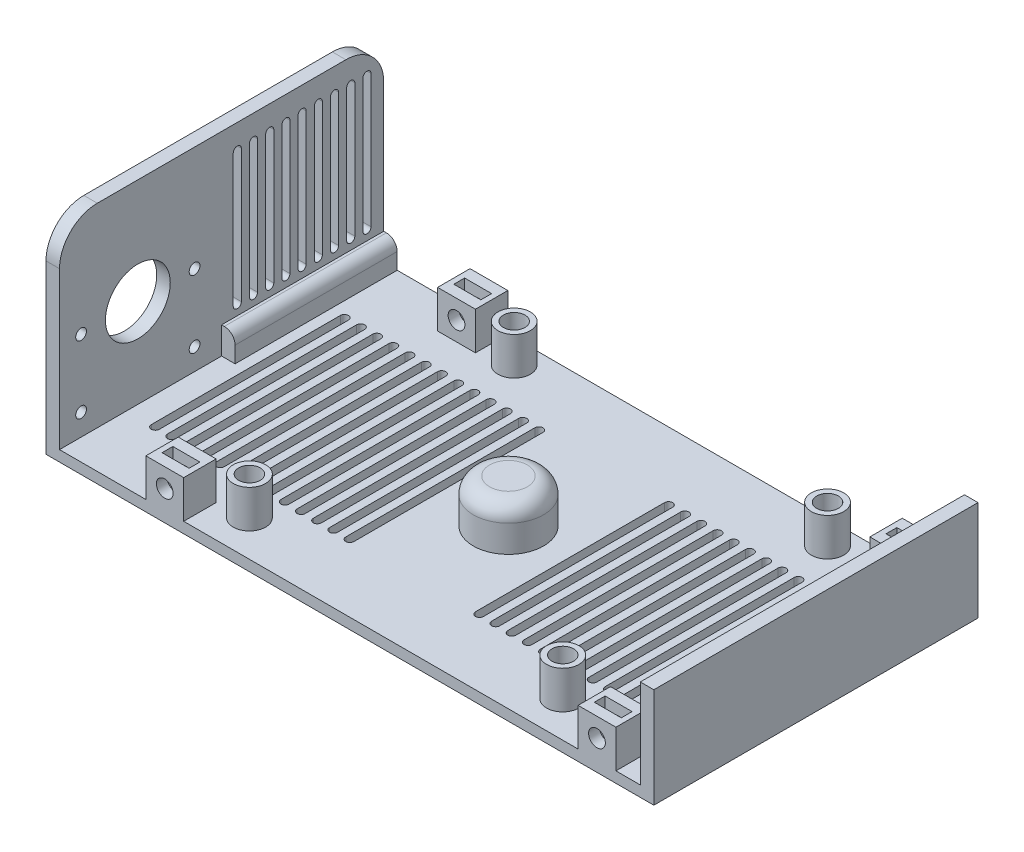
from build123d import *

# Parameters (mm, degrees)
SKETCH1_W            = 110
SKETCH1_H            = 60
BOSS_EXTRUDE1_DEPTH  = 2
SKETCH2_R            = 3
BOSS_EXTRUDE2_DEPTH  = 7
BOSS_EXTRUDE3_DEPTH  = 2.5
CUT_EXTRUDE1_REACH   = 135.042
SKETCH5_R            = 6
SKETCH6_R            = 2.5
CUT_EXTRUDE2_DEPTH   = 1
SKETCH7_R            = 1
CUT_EXTRUDE7_DEPTH   = 2.5
SKETCH8_W            = 7
SKETCH8_H            = 7
BOSS_EXTRUDE5_DEPTH  = 6
CUT_EXTRUDE9_DEPTH   = 2
SKETCH11_R           = 1.55
CUT_EXTRUDE11_DEPTH  = 131.935098427
LPATTERN1_COUNT      = 2
LPATTERN1_PITCH      = 80
LPATTERN1_COUNT_DIR2 = 2
LPATTERN1_PITCH_DIR2 = 54
SKETCH12_W           = 60
SKETCH12_H           = 16.51283607
BOSS_EXTRUDE6_DEPTH  = 2.5
SKETCH14_R           = 2
CUT_EXTRUDE12_DEPTH  = 6.5
CUT_EXTRUDE15_DEPTH  = 2.5
LPATTERN5_COUNT      = 9
LPATTERN5_PITCH      = 3
SKETCH17_R           = 6.5
BOSS_EXTRUDE7_DEPTH  = 8
SKETCH18_R           = 4.5
CUT_EXTRUDE16_DEPTH  = 8
FILLET2_R            = 3
CUT_EXTRUDE18_DEPTH  = 2
LPATTERN7_COUNT      = 34
LPATTERN7_PITCH      = 3
BOSS_EXTRUDE9_DEPTH  = 30


with BuildPart() as part:
    # Sketch1 → Boss-Extrude1 (new body)
    with BuildSketch(Plane(origin=(0, 0, 0), x_dir=(1, 0, 0), z_dir=(0, 1, 0))):
        with Locations((55, -30)):
            Rectangle(SKETCH1_W, SKETCH1_H)
    extrude(amount=BOSS_EXTRUDE1_DEPTH)

    # Sketch2 → Boss-Extrude2 (add)
    with BuildSketch(Plane(origin=(0, 2, 0), x_dir=(1, 0, 0), z_dir=(0, 1, 0))):
        with Locations(Location((28.5, -4.35, 0), (0, 0, 270))):
            Circle(SKETCH2_R)
        with Locations(Location((86.5, -4.35, 0), (0, 0, 270))):
            Circle(SKETCH2_R)
        with Locations(Location((28.5, -53.35, 0), (0, 0, 270))):
            Circle(SKETCH2_R)
        with Locations(Location((86.5, -53.35, 0), (0, 0, 270))):
            Circle(SKETCH2_R)
    extrude(amount=BOSS_EXTRUDE2_DEPTH)

    # Sketch3 → Boss-Extrude3 (add)
    with BuildSketch(Plane.ZY):
        with BuildLine():
            Line((0, 0), (60, 0))
            Line((60, 0), (60, 31))
            ThreePointArc((60, 31), (57.949747468, 35.949747468), (53, 38))
            Line((53, 38), (7, 38))
            ThreePointArc((7, 38), (2.050252532, 35.949747468), (0, 31))
            Line((0, 31), (0, 0))
        make_face()
    extrude(amount=BOSS_EXTRUDE3_DEPTH)

    # Sketch5 → Cut-Extrude1 (cut, up to next)
    with BuildSketch(Plane.ZY.offset(2.5), mode=Mode.PRIVATE) as cut_extrude1_sk1:
        with Locations((45.5, 18.5)):
            Circle(SKETCH5_R)
    cut_extrude1_tool1 = extrude(cut_extrude1_sk1.sketch, amount=-CUT_EXTRUDE1_REACH, mode=Mode.PRIVATE) & part.part
    add(cut_extrude1_tool1.solids().sort_by_distance((-2.5, 18.5, 45.5))[0], mode=Mode.SUBTRACT)

    # Sketch6 → Cut-Extrude2 (cut)
    with BuildSketch(Plane.ZY.offset(2.5)):
        with Locations((56, 18.5)):
            Circle(SKETCH6_R)
        with Locations((35, 18.5)):
            Circle(SKETCH6_R)
        with Locations((35, 6)):
            Circle(SKETCH6_R)
        with Locations((56, 6)):
            Circle(SKETCH6_R)
    extrude(amount=-CUT_EXTRUDE2_DEPTH, mode=Mode.SUBTRACT)

    # Sketch7 → Cut-Extrude7 (cut)
    with BuildSketch(Plane.ZY.offset(2.5)):
        with Locations((35, 18.5)):
            Circle(SKETCH7_R)
        with Locations((35, 6)):
            Circle(SKETCH7_R)
        with Locations((56, 6)):
            Circle(SKETCH7_R)
        with Locations((56, 18.5)):
            Circle(SKETCH7_R)
    extrude(amount=-CUT_EXTRUDE7_DEPTH, mode=Mode.SUBTRACT)

    # Sketch8 → Boss-Extrude5 (add)
    with BuildSketch(Plane.XY.offset(60)):
        with Locations((99.480486657, 5.5)):
            Rectangle(SKETCH8_W, SKETCH8_H)
    boss_extrude5 = extrude(amount=-BOSS_EXTRUDE5_DEPTH)

    # Sketch9 → Cut-Extrude9 (cut)
    with BuildSketch(Plane.XY.offset(58)):
        Polygon((99.480486657, 2.613248654), (101.980486657, 4.056624327), (101.980486657, 9), (96.980486657, 9), (96.980486657, 4.056624327), align=None)
    cut_extrude9 = extrude(amount=-CUT_EXTRUDE9_DEPTH, mode=Mode.SUBTRACT)

    # Sketch11 → Cut-Extrude11 (cut, through all)
    with BuildSketch(Plane.XY.offset(60)):
        with Locations((99.480486657, 5.5)):
            Circle(SKETCH11_R)
    cut_extrude11 = extrude(amount=-CUT_EXTRUDE11_DEPTH, mode=Mode.SUBTRACT)

    # LPattern1: Boss-Extrude5, Cut-Extrude9, Cut-Extrude11 2 × 2
    with Locations(*[(-i * LPATTERN1_PITCH, 0, -j * LPATTERN1_PITCH_DIR2) for i in range(LPATTERN1_COUNT) for j in range(LPATTERN1_COUNT_DIR2) if (i, j) != (0, 0)]):
        add(boss_extrude5)
        add(cut_extrude9, mode=Mode.SUBTRACT)
        add(cut_extrude11, mode=Mode.SUBTRACT)

    # Sketch12 → Boss-Extrude6 (add)
    with BuildSketch(Plane(origin=(110, 0, 0), x_dir=(0, 0, -1), z_dir=(1, 0, 0))):
        with Locations((-30, 10.256418035)):
            Rectangle(SKETCH12_W, SKETCH12_H)
    extrude(amount=-BOSS_EXTRUDE6_DEPTH)

    # Sketch14 → Cut-Extrude12 (cut)
    with BuildSketch(Plane(origin=(0, 9, 0), x_dir=(1, 0, 0), z_dir=(0, 1, 0))):
        with Locations(Location((28.5, -53.35, 0), (0, 0, 270))):
            Circle(SKETCH14_R)
        with Locations(Location((86.5, -53.35, 0), (0, 0, 270))):
            Circle(SKETCH14_R)
        with Locations(Location((28.5, -4.35, 0), (0, 0, 270))):
            Circle(SKETCH14_R)
        with Locations(Location((86.5, -4.35, 0), (0, 0, 270))):
            Circle(SKETCH14_R)
    extrude(amount=-CUT_EXTRUDE12_DEPTH, mode=Mode.SUBTRACT)

    # Sketch15 → Cut-Extrude15 (cut)
    with BuildSketch(Plane.ZY.offset(2.5)):
        with BuildLine():
            Line((3.842859367, 33.468156302), (3.842859367, 8.893132063))
            ThreePointArc((3.842859367, 8.893132063), (3.092859367, 8.143132063), (2.342859367, 8.893132063))
            Line((2.342859367, 8.893132063), (2.342859367, 33.468156302))
            ThreePointArc((2.342859367, 33.468156302), (3.092859367, 34.218156302), (3.842859367, 33.468156302))
        make_face()
    cut_extrude15 = extrude(amount=-CUT_EXTRUDE15_DEPTH, mode=Mode.SUBTRACT)

    # LPattern5: Cut-Extrude15 ×9
    with Locations(*[(0, 0, i * LPATTERN5_PITCH) for i in range(1, LPATTERN5_COUNT)]):
        add(cut_extrude15, mode=Mode.SUBTRACT)

    # Sketch17 → Boss-Extrude7 (add)
    with BuildSketch(Plane(origin=(0, 2, 0), x_dir=(1, 0, 0), z_dir=(0, 1, 0))):
        with Locations(Location((53.75, -30.655008799, 0), (0, 0, 270))):
            Circle(SKETCH17_R)
    extrude(amount=BOSS_EXTRUDE7_DEPTH)

    # Sketch18 → Cut-Extrude16 (cut)
    with BuildSketch(Plane.XZ):
        with Locations(Location((53.75, 30.655008799, 0), (0, 0, 270))):
            Circle(SKETCH18_R)
    extrude(amount=-CUT_EXTRUDE16_DEPTH, mode=Mode.SUBTRACT)

    # Fillet2
    fillet2_edges = [part.edges().sort_by_distance(p)[0] for p in [
        (53.75, 10, 24.155008799),
    ]]
    fillet(fillet2_edges, radius=FILLET2_R)

    # Sketch19 → Cut-Extrude18 (cut)
    with BuildSketch(Plane(origin=(0, 2, 0), x_dir=(1, 0, 0), z_dir=(0, 1, 0))):
        with BuildLine():
            Line((5.981374352, -12.5), (5.981374352, -47.5))
            ThreePointArc((5.981374352, -47.5), (5.231374352, -48.25), (4.481374352, -47.5))
            Line((4.481374352, -47.5), (4.481374352, -12.5))
            ThreePointArc((4.481374352, -12.5), (5.231374352, -11.75), (5.981374352, -12.5))
        make_face()
    cut_extrude18 = extrude(amount=-CUT_EXTRUDE18_DEPTH, mode=Mode.SUBTRACT)

    # LPattern7: Cut-Extrude18 ×34, 7 skipped
    with Locations(*[(i * LPATTERN7_PITCH, 0, 0) for i in range(1, LPATTERN7_COUNT) if i not in (13, 14, 15, 16, 17, 18, 19)]):
        add(cut_extrude18, mode=Mode.SUBTRACT)

    # Sketch21 → Boss-Extrude9 (add)
    with BuildSketch(Plane(origin=(0, 0, 0), x_dir=(-1, 0, 0), z_dir=(0, 0, -1))):
        with BuildLine():
            Line((0, 2), (-2.5, 2))
            Line((-2.5, 2), (-2.5, 5))
            ThreePointArc((-2.5, 5), (-1.914213562, 6.414213562), (-0.5, 7))
            Line((-0.5, 7), (0, 7))
            Line((0, 7), (0, 2))
        make_face()
    extrude(amount=-BOSS_EXTRUDE9_DEPTH)


solid = part.part
